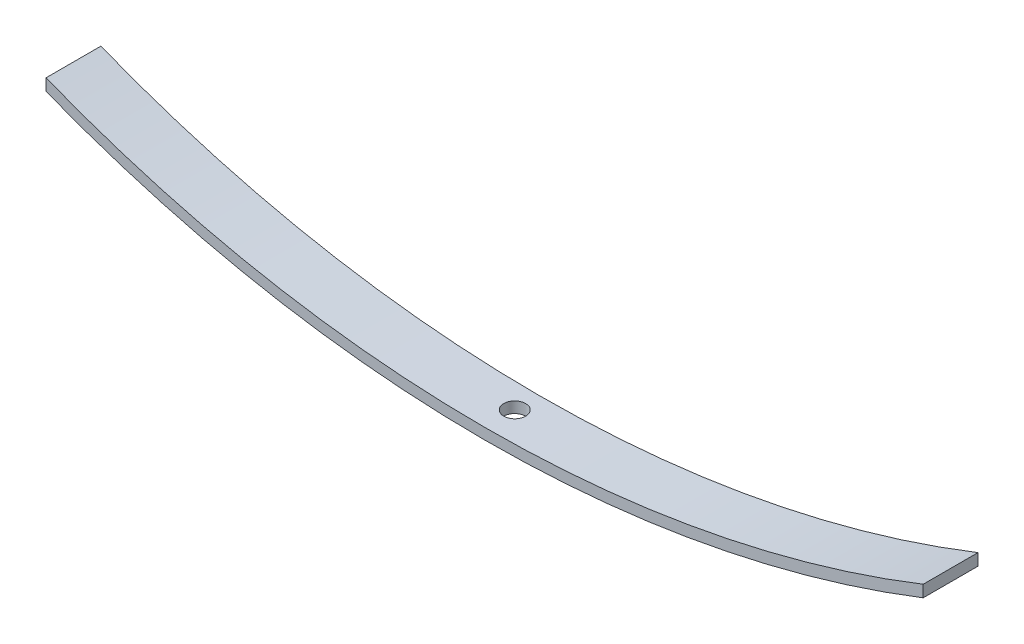
from build123d import *

# Parameters (mm, degrees)
BOSS_EXTRUDE1_DEPTH = 50
SKETCH3_R           = 10
CUT_EXTRUDE1_DEPTH  = 1172.537451386


with BuildPart() as part:
    # Sketch1 → Boss-Extrude1 (new body)
    with BuildSketch(Plane.XY):
        with BuildLine():
            Line((-400, -1024.695076596), (-400, -1013.952661617))
            ThreePointArc((-400, -1013.952661617), (0, -1090), (400, -1013.952661617))
            Line((400, -1013.952661617), (400, -1024.695076596))
            ThreePointArc((400, -1024.695076596), (0, -1100), (-400, -1024.695076596))
        make_face()
    extrude(amount=BOSS_EXTRUDE1_DEPTH)

    # Sketch3 → Cut-Extrude1 (cut, through all)
    with BuildSketch(Plane(origin=(0, 0, 0), x_dir=(1, 0, 0), z_dir=(0, 1, 0))):
        with Locations(Location((0, -22.5, 0), (0, 0, 270))):
            Circle(SKETCH3_R)
    extrude(amount=-CUT_EXTRUDE1_DEPTH, mode=Mode.SUBTRACT)


solid = part.part
